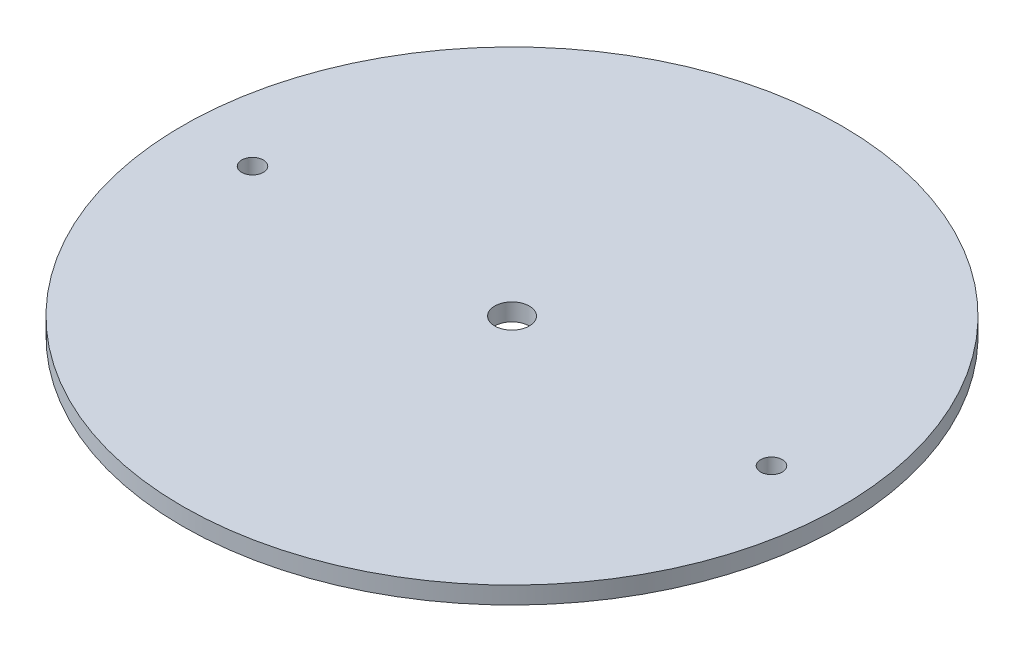
from build123d import *

# Parameters (mm, degrees)
SKETCH1_R           = 76.2
SKETCH1_R_2         = 4
SKETCH1_R_3         = 2.5
BOSS_EXTRUDE1_DEPTH = 4


with BuildPart() as part:
    # Sketch1 → Boss-Extrude1 (new body)
    with BuildSketch(Plane(origin=(0, 0, 0), x_dir=(1, 0, 0), z_dir=(0, 1, 0))):
        with Locations(Location((0, 0, 0), (0, 0, 270))):
            Circle(SKETCH1_R)
        with Locations(Location((0, 0, 0), (0, 0, 270))):
            Circle(SKETCH1_R_2, mode=Mode.SUBTRACT)
        with Locations(Location((-60, 0, 0), (0, 0, 270))):
            Circle(SKETCH1_R_3, mode=Mode.SUBTRACT)
        with Locations(Location((60, 0, 0), (0, 0, 270))):
            Circle(SKETCH1_R_3, mode=Mode.SUBTRACT)
    extrude(amount=BOSS_EXTRUDE1_DEPTH)


solid = part.part
